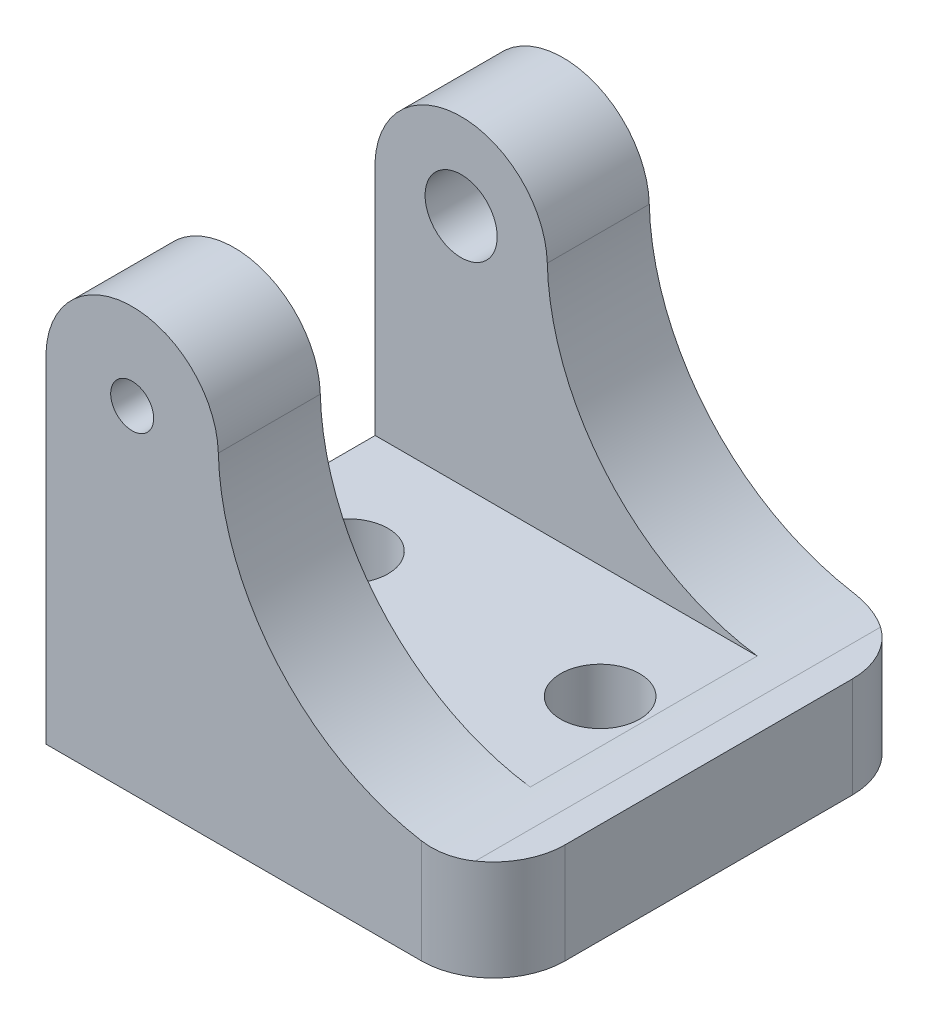
from build123d import *

# Parameters (mm, degrees)
BOSS_EXTRUDE1_DEPTH                              = 38.1
CUT_EXTRUDE1_DEPTH                               = 67.382149086
CUT_EXTRUDE1_DEPTH_BACK                          = 67.382149086
SKETCH3_W                                        = 20.066
SKETCH3_H                                        = 28.2194
F_10_24_TAPPED_HOLE1_D                           = 3.7973
F_10_24_TAPPED_HOLE1_DEPTH                       = 12.954
F_10_24_TAPPED_HOLE1_TIP                         = 1.140824014
CBORE_FOR_1_4_SOCKET_SHOULDER_SCREW1_D           = 6.3754
CBORE_FOR_1_4_SOCKET_SHOULDER_SCREW1_DEPTH       = 9.017
CBORE_FOR_1_4_SOCKET_SHOULDER_SCREW1_CBORE_D     = 10.2616
CBORE_FOR_1_4_SOCKET_SHOULDER_SCREW1_CBORE_DEPTH = 3.8862
SKETCH13_R                                       = 3.4925
CUT_EXTRUDE2_DEPTH                               = 57.885100215
FILLET1_R                                        = 6.35


with BuildPart() as part:
    # Sketch1 → Boss-Extrude1 (new body)
    with BuildSketch(Plane.XY):
        with BuildLine():
            Line((-19.7612, 0), (19.7612, 0))
            Line((19.7612, 0), (19.7612, 8.89))
            Line((19.7612, 8.89), (17.037205242, 8.89))
            ThreePointArc((17.037205242, 8.89), (1.975351394, 15.011688564), (-4.545142708, 29.905233101))
            ThreePointArc((-4.545142708, 29.905233101), (-12.548269927, 37.3126), (-19.7612, 29.1338))
            Line((-19.7612, 29.1338), (-19.7612, 0))
        make_face()
    extrude(amount=-BOSS_EXTRUDE1_DEPTH)

    # Sketch3 → Cut-Extrude1 (cut, two sides: drawn at the far end of the back side and taken through both)
    with BuildSketch(Plane.ZY.offset(19.7612).offset(-CUT_EXTRUDE1_DEPTH_BACK)):
        with Locations((-19.05, 23.212674195)):
            Rectangle(SKETCH3_W, SKETCH3_H)
    extrude(amount=CUT_EXTRUDE1_DEPTH + CUT_EXTRUDE1_DEPTH_BACK, mode=Mode.SUBTRACT)

    # #10-24 Tapped Hole1
    with Locations(Plane.XY):
        with Locations((-12.162441984, 29.702374195)):
            Hole(F_10_24_TAPPED_HOLE1_D / 2, depth=F_10_24_TAPPED_HOLE1_DEPTH)
            with Locations((0, 0, -(F_10_24_TAPPED_HOLE1_DEPTH + F_10_24_TAPPED_HOLE1_TIP / 2))):  # 118° drill point
                Cone(0, F_10_24_TAPPED_HOLE1_D / 2, F_10_24_TAPPED_HOLE1_TIP, mode=Mode.SUBTRACT)

    # CBORE for 1/4 Socket Shoulder Screw1
    with Locations(Plane(origin=(0, 0, -38.1), x_dir=(-1, 0, 0), z_dir=(0, 0, -1))):
        with Locations((12.162441984, 29.702374195)):
            CounterBoreHole(CBORE_FOR_1_4_SOCKET_SHOULDER_SCREW1_D / 2, CBORE_FOR_1_4_SOCKET_SHOULDER_SCREW1_CBORE_D / 2, CBORE_FOR_1_4_SOCKET_SHOULDER_SCREW1_CBORE_DEPTH, depth=CBORE_FOR_1_4_SOCKET_SHOULDER_SCREW1_DEPTH)

    # Sketch13 → Cut-Extrude2 (cut, through all)
    with BuildSketch(Plane.XZ):
        with Locations((-12.0904, -19.05)):
            Circle(SKETCH13_R)
        with Locations((10.16, -19.05)):
            Circle(SKETCH13_R)
    extrude(amount=-CUT_EXTRUDE2_DEPTH, mode=Mode.SUBTRACT)

    # Fillet1
    fillet1_edges = [part.edges().sort_by_distance(p)[0] for p in [
        (19.7612, 4.445, -38.1),
        (19.7612, 4.445, 0),
    ]]
    fillet(fillet1_edges, radius=FILLET1_R)


solid = part.part
